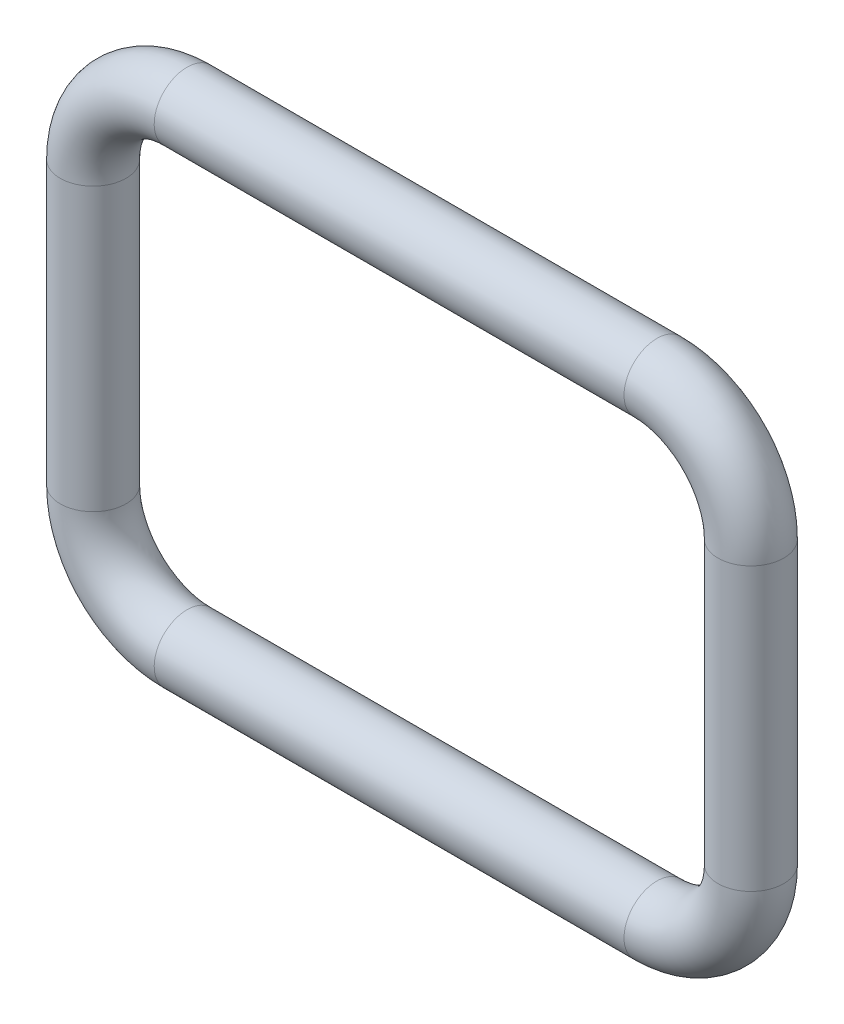
from build123d import *

# Parameters (mm, degrees)
SWEEP2_PROFILE_R = 0.35


with BuildPart() as part:
    # Sweep2: sweep along a path in Sketch1
    with BuildLine(Plane.XY) as sweep2_path:
        Line((-3.615384615, 4), (-3.615384615, 1))
        ThreePointArc((-3.615384615, 1), (-3.322491397, 0.292893219), (-2.615384615, 0))
        Line((-2.615384615, 0), (2.384615385, 0))
        ThreePointArc((2.384615385, 0), (3.091722166, 0.292893219), (3.384615385, 1))
        Line((3.384615385, 1), (3.384615385, 4))
        ThreePointArc((3.384615385, 4), (3.091722166, 4.707106781), (2.384615385, 5))
        Line((2.384615385, 5), (-2.615384615, 5))
        ThreePointArc((-2.615384615, 5), (-3.322491397, 4.707106781), (-3.615384615, 4))
    # Sweep2 profile (on start of the path) → Sweep2 (sweep)
    with BuildSketch(Plane(origin=(-3.615384615, 4, 0), x_dir=(0, 0, -1), z_dir=(0, -1, 0))):
        Circle(SWEEP2_PROFILE_R)
    sweep(path=sweep2_path.line)


solid = part.part
